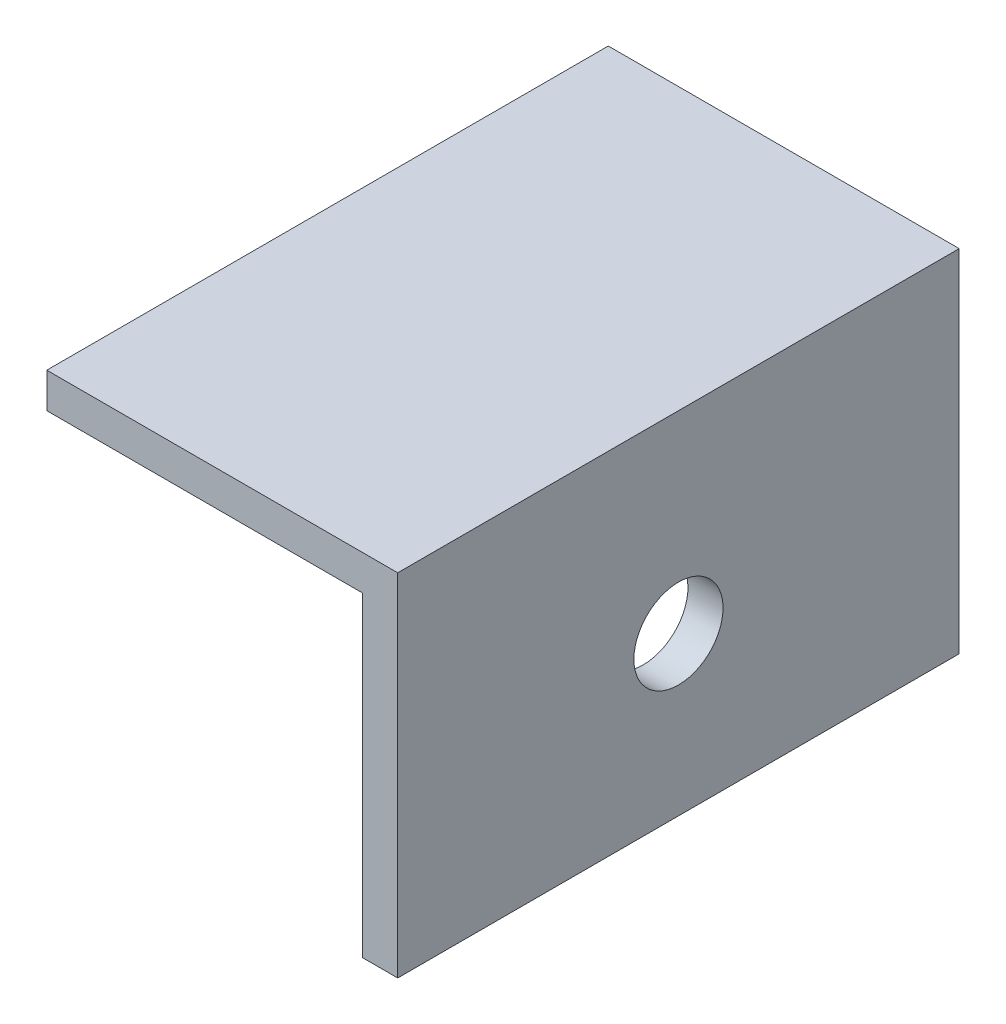
from build123d import *

# Parameters (mm, degrees)
SALIENTE_EXTRUIR1_DEPTH = 80
CORTAR_EXTRUIR1_REACH   = 106.523
CROQUIS2_R              = 6.35


with BuildPart() as part:
    # Croquis1 → Saliente-Extruir1 (new body)
    with BuildSketch(Plane.XY):
        Polygon((0, 0), (0, 50), (-50, 50), (-50, 45), (-5, 45), (-5, 0), align=None)
    extrude(amount=SALIENTE_EXTRUIR1_DEPTH)

    # Croquis2 → Cortar-Extruir1 (cut, up to next)
    with BuildSketch(Plane.ZY.offset(5), mode=Mode.PRIVATE) as cortar_extruir1_sk1:
        with Locations(Location((40, 22.5, 0), (0, 0, 270))):
            Circle(CROQUIS2_R)
    cortar_extruir1_tool1 = extrude(cortar_extruir1_sk1.sketch, amount=-CORTAR_EXTRUIR1_REACH, mode=Mode.PRIVATE) & part.part
    add(cortar_extruir1_tool1.solids().sort_by_distance((-5, 22.5, 40))[0], mode=Mode.SUBTRACT)


solid = part.part
